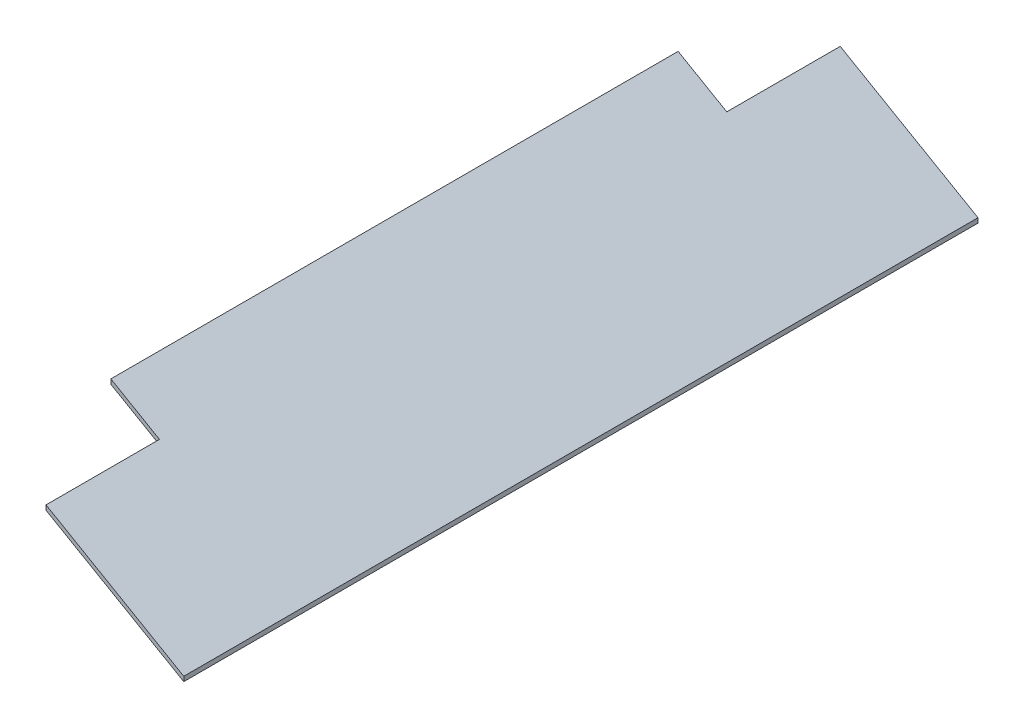
from build123d import *

# Parameters (mm, degrees)
BOSS_EXTRUDE1_DEPTH = 311.15
SKETCH2_W           = 38.1
SKETCH2_H           = 88.9
CUT_EXTRUDE1_DEPTH  = 354.914009094


with BuildPart() as part:
    # Sketch1 → Boss-Extrude1 (new, symmetric)
    with BuildSketch(Plane.XY):
        Polygon((0, 0), (0, -3.666174209), (-146.05, 80.655832606), (-146.05, 84.322006815), align=None)
    extrude(amount=BOSS_EXTRUDE1_DEPTH, both=True)

    # Sketch2 → Cut-Extrude1 (cut, through all)
    with BuildSketch(Plane(origin=(0, 0, 0), x_dir=(1, 0, 0), z_dir=(0, 1, 0))):
        with Locations((-127, -266.7)):
            Rectangle(SKETCH2_W, SKETCH2_H)
        with Locations((-127, 266.7)):
            Rectangle(SKETCH2_W, SKETCH2_H)
    extrude(amount=CUT_EXTRUDE1_DEPTH, mode=Mode.SUBTRACT)


solid = part.part
